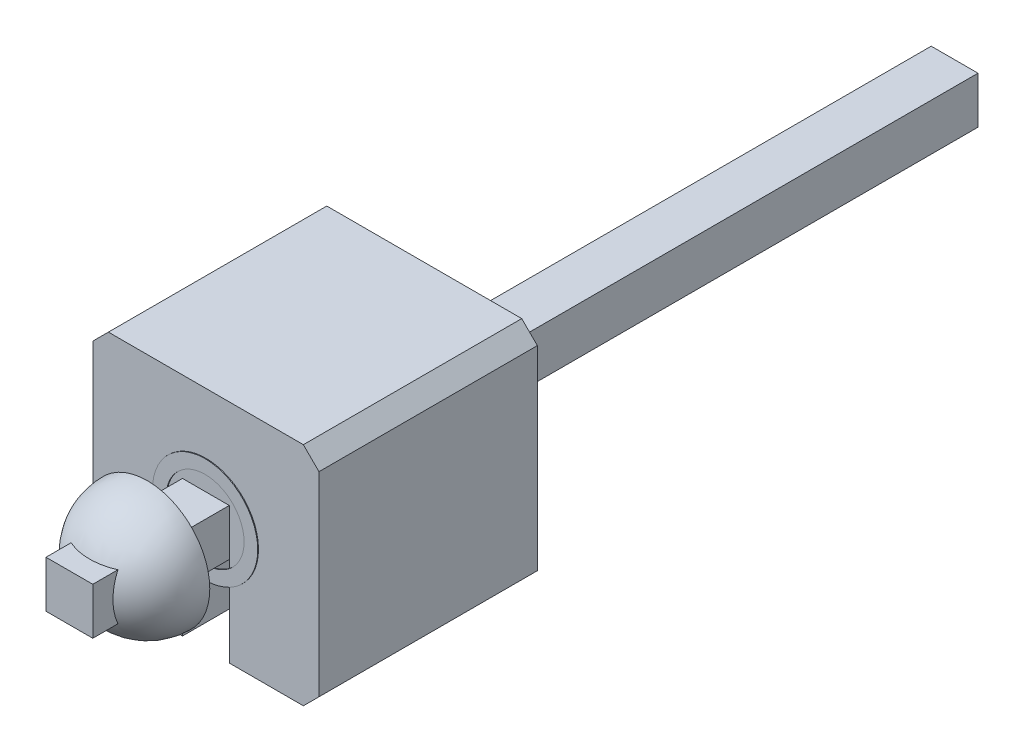
from build123d import *

# Parameters (mm, degrees)
ESQUISSE1_W             = 0.6
ESQUISSE1_H             = 0.6
BOSS_EXTRU_1_DEPTH      = 2.8
ESQUISSE2_W             = 0.6
ESQUISSE2_H             = 1.15
ENL_V_MAT_EXTRU_1_DEPTH = 1
BOSS_EXTRU_2_DEPTH      = 0.75
BOSS_EXTRU_2_DEPTH_BACK = 9.8
ESQUISSE3_W             = 0.6
ESQUISSE3_H             = 0.6
CHANFREIN1_SIZE         = 0.2
ESQUISSE4_R             = 0.674645205
ESQUISSE4_R_2           = 0.5
BOSS_EXTRU_3_DEPTH      = 0.01
R_VOLUTION1_ANGLE       = 180
ESQUISSE6_W             = 0.6
ESQUISSE6_H             = 0.6
BOSS_EXTRU_4_DEPTH      = 1


with BuildPart() as part:
    # Esquisse1 → Boss.-Extru.1 (new body)
    with BuildSketch(Plane.XY):
        Polygon((-1.25, 1.45), (-1.45, 1.25), (-1.45, -1.25), (-1.25, -1.45), (1.25, -1.45), (1.45, -1.25), (1.45, 1.25), (1.25, 1.45), align=None)
        Rectangle(ESQUISSE1_W, ESQUISSE1_H, mode=Mode.SUBTRACT)
    extrude(amount=BOSS_EXTRU_1_DEPTH)

    # Esquisse2 → Enlèv. mat.-Extru.1 (cut)
    with BuildSketch(Plane.XY.offset(2.8)):
        with Locations((0, -0.875)):
            Rectangle(ESQUISSE2_W, ESQUISSE2_H)
    extrude(amount=-ENL_V_MAT_EXTRU_1_DEPTH, mode=Mode.SUBTRACT)

    # Esquisse3 → Boss.-Extru.2 (add, two sides: drawn at the far end of the back side and taken through both)
    with BuildSketch(Plane.XY.offset(2.8).offset(-BOSS_EXTRU_2_DEPTH_BACK)):
        Rectangle(ESQUISSE3_W, ESQUISSE3_H)
    extrude(amount=BOSS_EXTRU_2_DEPTH + BOSS_EXTRU_2_DEPTH_BACK)

    # Chanfrein1
    chanfrein1_edges = [part.edges().sort_by_distance(p)[0] for p in [
        (0, -0.3, -7),
        (0.3, 0, -7),
        (-0.3, 0, -7),
        (0, 0.3, -7),
    ]]
    chamfer(chanfrein1_edges, length=CHANFREIN1_SIZE)

    # Esquisse4 → Boss.-Extru.3 (add)
    with BuildSketch(Plane.XY.offset(2.8)):
        with Locations(Location((0, 0, 0), (0, 0, 243.597249523))):
            Circle(ESQUISSE4_R)
        with Locations(Location((0, 0, 0), (0, 0, 233.130102354))):
            Circle(ESQUISSE4_R_2, mode=Mode.SUBTRACT)
    extrude(amount=BOSS_EXTRU_3_DEPTH)

    # Esquisse5 → Révolution1 (revolve)
    with BuildSketch(Plane.XY.offset(3.55)):
        with BuildLine():
            Line((0.8, 0), (-0.8, 0))
            ThreePointArc((-0.8, 0), (0, 0.8), (0.8, 0))
        make_face()
    revolve(axis=Axis((0.8, 0, 3.55), (1, 0, 0)), revolution_arc=R_VOLUTION1_ANGLE)

    # Esquisse6 → Boss.-Extru.4 (add)
    with BuildSketch(Plane(origin=(0, 0, 3.55), x_dir=(-1, 0, 0), z_dir=(0, 0, -1))):
        Rectangle(ESQUISSE6_W, ESQUISSE6_H)
    extrude(amount=-BOSS_EXTRU_4_DEPTH)


solid = part.part
